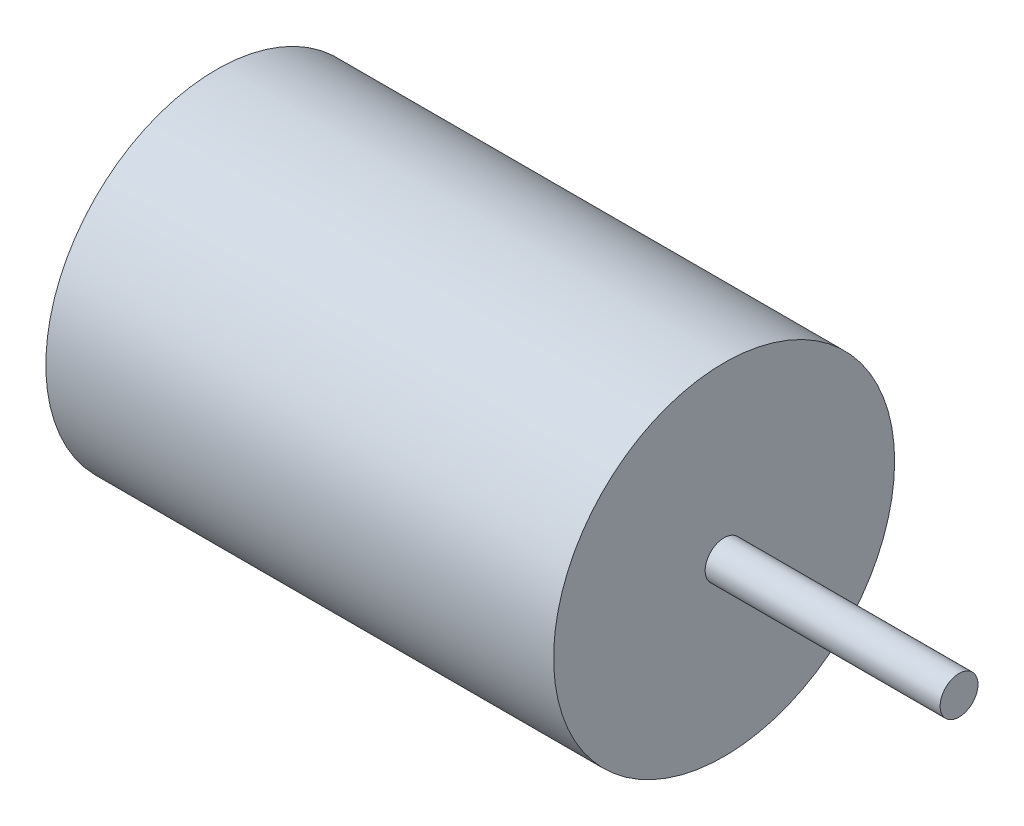
from build123d import *

# Parameters (mm, degrees)
SKETCH2_R           = 22.5
BOSS_EXTRUDE1_DEPTH = 67
SKETCH3_R           = 2.5
BOSS_EXTRUDE2_DEPTH = 31


with BuildPart() as part:
    # Sketch2 → Boss-Extrude1 (new body)
    with BuildSketch(Plane(origin=(0, 0, 0), x_dir=(0, 0, -1), z_dir=(1, 0, 0))):
        Circle(SKETCH2_R)
    extrude(amount=BOSS_EXTRUDE1_DEPTH)

    # Sketch3 → Boss-Extrude2 (add)
    with BuildSketch(Plane(origin=(67, 0, 0), x_dir=(0, 0, -1), z_dir=(1, 0, 0))):
        Circle(SKETCH3_R)
    extrude(amount=BOSS_EXTRUDE2_DEPTH)


solid = part.part
